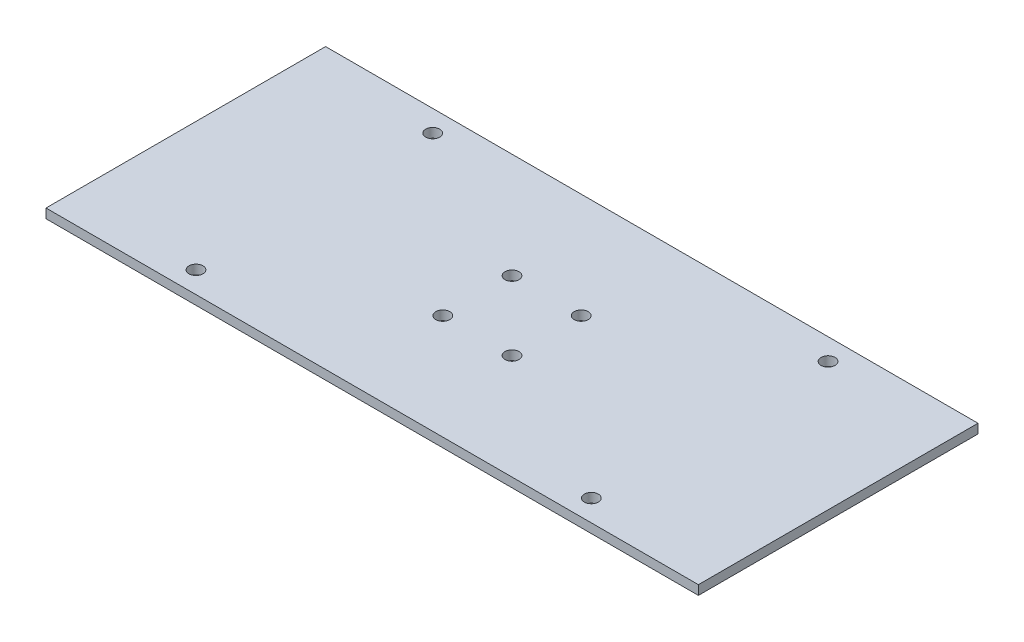
from build123d import *

# Parameters (mm, degrees)
SKETCH_1_W      = 140
SKETCH_1_H      = 60
SKETCH_1_R      = 1.5
EXTRUDE_1_DEPTH = 2


with BuildPart() as part:
    # 草图1 → 凸台-拉伸1 (new body)
    with BuildSketch(Plane(origin=(0, 0, 0), x_dir=(1, 0, 0), z_dir=(0, 1, 0))):
        Rectangle(SKETCH_1_W, SKETCH_1_H)
        with Locations(Location((-42.42, 25.4, 0), (0, 0, 270))):
            Circle(SKETCH_1_R, mode=Mode.SUBTRACT)
        with Locations(Location((-42.42, -25.4, 0), (0, 0, 90))):
            Circle(SKETCH_1_R, mode=Mode.SUBTRACT)
        with Locations(Location((42.42, -25.4, 0), (0, 0, 270))):
            Circle(SKETCH_1_R, mode=Mode.SUBTRACT)
        with Locations(Location((42.42, 25.4, 0), (0, 0, 90))):
            Circle(SKETCH_1_R, mode=Mode.SUBTRACT)
        with Locations(Location((-7.425, 7.425, 0), (0, 0, 270))):
            Circle(SKETCH_1_R, mode=Mode.SUBTRACT)
        with Locations(Location((7.425, 7.425, 0), (0, 0, 270))):
            Circle(SKETCH_1_R, mode=Mode.SUBTRACT)
        with Locations(Location((7.425, -7.425, 0), (0, 0, 270))):
            Circle(SKETCH_1_R, mode=Mode.SUBTRACT)
        with Locations(Location((-7.425, -7.425, 0), (0, 0, 270))):
            Circle(SKETCH_1_R, mode=Mode.SUBTRACT)
    extrude(amount=EXTRUDE_1_DEPTH)


solid = part.part
